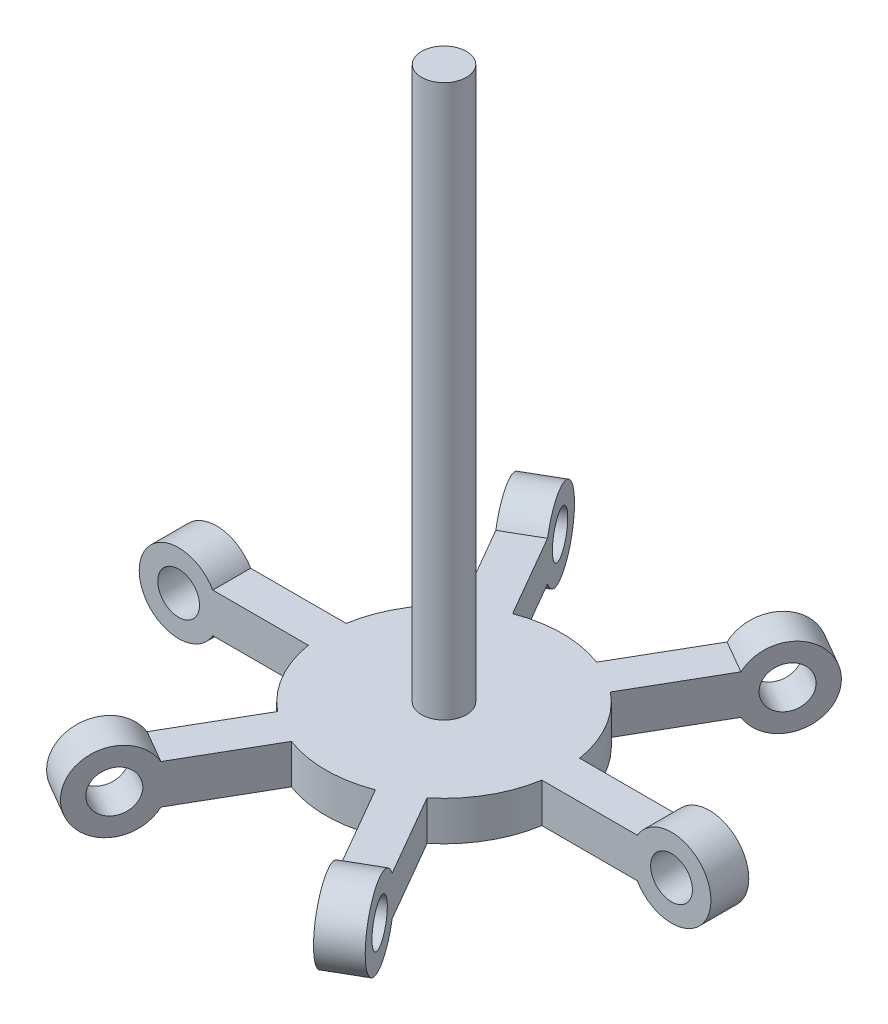
from build123d import *

# Parameters (mm, degrees)
SKETCH_1_R               = 30
EXTRUDE_1_DEPTH          = 5
SKETCH_2_W               = 50
SKETCH_2_H               = 9.6
EXTRUDE_2_DEPTH          = 5
SKETCH_3_R               = 10
EXTRUDE_3_DEPTH          = 9.6
SKETCH_4_R               = 5.3
CUT_EXTRUDE_1_DEPTH      = 10
PATTERN_CIRCULAR_1_COUNT = 6
SKETCH_5_R               = 5.7
EXTRUDE_11_4_140_DEPTH   = 140


with BuildPart() as part:
    # 草图1 → 凸台-拉伸1 (new, symmetric)
    with BuildSketch(Plane(origin=(0, 0, 0), x_dir=(1, 0, 0), z_dir=(0, 1, 0))):
        with Locations(Location((0, 0, 0), (0, 0, 270))):
            Circle(SKETCH_1_R)
    extrude(amount=EXTRUDE_1_DEPTH, both=True)

    # 草图2 → 凸台-拉伸2 (add, symmetric)
    with BuildSketch(Plane(origin=(0, 0, 0), x_dir=(1, 0, 0), z_dir=(0, 1, 0))):
        with Locations((45, 0)):
            Rectangle(SKETCH_2_W, SKETCH_2_H)
    extrude_2 = extrude(amount=EXTRUDE_2_DEPTH, both=True)

    # 草图3 → 凸台-拉伸3 (add)
    with BuildSketch(Plane.XY.offset(4.8)):
        with Locations((62.5, 0)):
            Circle(SKETCH_3_R)
    extrude_3 = extrude(amount=-EXTRUDE_3_DEPTH)

    # 草图4 → 切除-拉伸1 (cut)
    with BuildSketch(Plane.XY.offset(4.8)):
        with Locations((62.5, 0)):
            Circle(SKETCH_4_R)
    cut_extrude_1 = extrude(amount=-CUT_EXTRUDE_1_DEPTH, mode=Mode.SUBTRACT)

    # 阵列(圆周)1: 凸台-拉伸2, 凸台-拉伸3, 切除-拉伸1 ×6 about axis
    pattern_circular_1_axis = Axis((0, 5, 0), (0, -1, 0))
    add([extrude_2.rotate(pattern_circular_1_axis, i * 360 / PATTERN_CIRCULAR_1_COUNT) for i in range(1, PATTERN_CIRCULAR_1_COUNT)])
    add([extrude_3.rotate(pattern_circular_1_axis, i * 360 / PATTERN_CIRCULAR_1_COUNT) for i in range(1, PATTERN_CIRCULAR_1_COUNT)])
    add([cut_extrude_1.rotate(pattern_circular_1_axis, i * 360 / PATTERN_CIRCULAR_1_COUNT) for i in range(1, PATTERN_CIRCULAR_1_COUNT)], mode=Mode.SUBTRACT)

    # 草图5 → 细杆_直径11.4_长度140 (add)
    with BuildSketch(Plane(origin=(0, 5, 0), x_dir=(1, 0, 0), z_dir=(0, 1, 0))):
        with Locations(Location((0, 0, 0), (0, 0, 270))):
            Circle(SKETCH_5_R)
    extrude(amount=EXTRUDE_11_4_140_DEPTH)


solid = part.part
